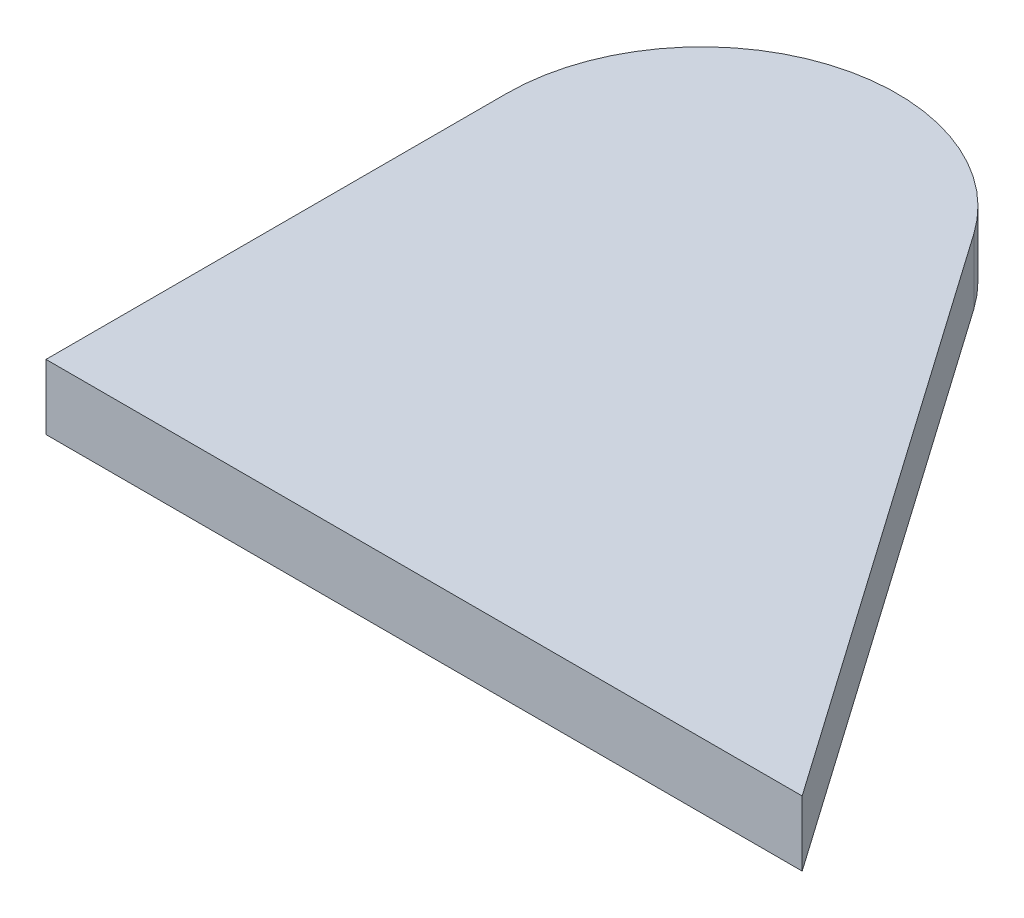
from build123d import *

# Parameters (mm, degrees)
BOSS_EXTRUDE2_DEPTH = 6.35


with BuildPart() as part:
    # Sketch1 → Boss-Extrude2 (new body)
    with BuildSketch(Plane(origin=(0, 0, 0), x_dir=(1, 0, 0), z_dir=(0, 1, 0))):
        with BuildLine():
            Line((19.05, 0), (73.760800633, 0))
            Line((73.760800633, 0), (34.654846444, 55.849090528))
            ThreePointArc((34.654846444, 55.849090528), (13.321554519, 63.090767327), (0, 44.922459415))
            Line((0, 44.922459415), (0, 0))
            Line((0, 0), (19.05, 0))
        make_face()
    extrude(amount=BOSS_EXTRUDE2_DEPTH)


solid = part.part
